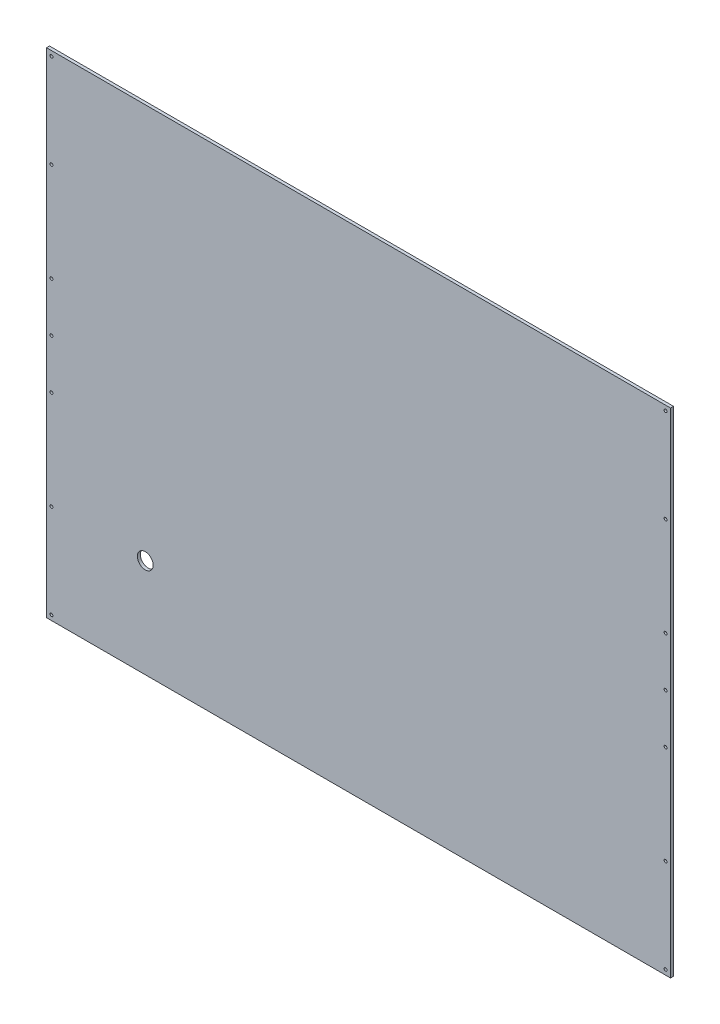
from build123d import *

# Parameters (mm, degrees)
SKETCH_1_W      = 632
SKETCH_1_H      = 500
SKETCH_1_R      = 1.5
SKETCH_1_R_2    = 8
EXTRUDE_1_DEPTH = 3


with BuildPart() as part:
    # 草图1 → 凸台-拉伸1 (new body)
    with BuildSketch(Plane.XY):
        with Locations((316, 250)):
            Rectangle(SKETCH_1_W, SKETCH_1_H)
        with Locations((627, 250)):
            Circle(SKETCH_1_R, mode=Mode.SUBTRACT)
        with Locations((627, 300)):
            Circle(SKETCH_1_R, mode=Mode.SUBTRACT)
        with Locations((627, 400)):
            Circle(SKETCH_1_R, mode=Mode.SUBTRACT)
        with Locations((627, 495)):
            Circle(SKETCH_1_R, mode=Mode.SUBTRACT)
        with Locations(Location((627, 5, 0), (0, 0, 180))):
            Circle(SKETCH_1_R, mode=Mode.SUBTRACT)
        with Locations(Location((627, 100, 0), (0, 0, 180))):
            Circle(SKETCH_1_R, mode=Mode.SUBTRACT)
        with Locations(Location((627, 200, 0), (0, 0, 180))):
            Circle(SKETCH_1_R, mode=Mode.SUBTRACT)
        with Locations((5, 200)):
            Circle(SKETCH_1_R, mode=Mode.SUBTRACT)
        with Locations((5, 100)):
            Circle(SKETCH_1_R, mode=Mode.SUBTRACT)
        with Locations((5, 5)):
            Circle(SKETCH_1_R, mode=Mode.SUBTRACT)
        with Locations(Location((5, 495, 0), (0, 0, 180))):
            Circle(SKETCH_1_R, mode=Mode.SUBTRACT)
        with Locations(Location((5, 400, 0), (0, 0, 180))):
            Circle(SKETCH_1_R, mode=Mode.SUBTRACT)
        with Locations(Location((5, 300, 0), (0, 0, 180))):
            Circle(SKETCH_1_R, mode=Mode.SUBTRACT)
        with Locations(Location((5, 250, 0), (0, 0, 180))):
            Circle(SKETCH_1_R, mode=Mode.SUBTRACT)
        with Locations((100, 100)):
            Circle(SKETCH_1_R_2, mode=Mode.SUBTRACT)
    extrude(amount=EXTRUDE_1_DEPTH)


solid = part.part
